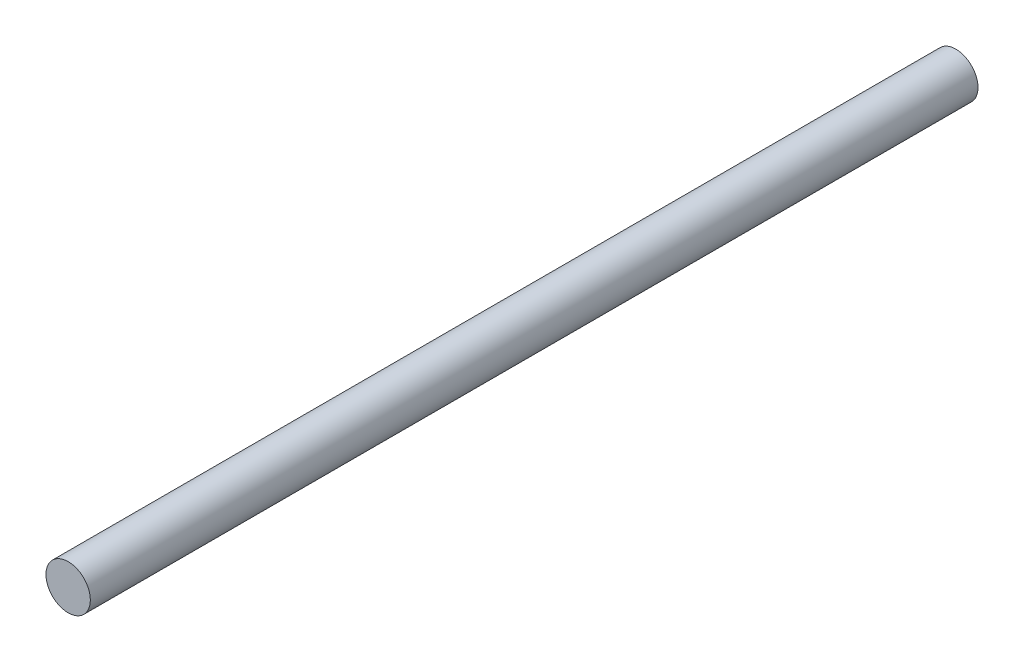
from build123d import *

# Parameters (mm, degrees)
SKETCH_1_R      = 10
EXTRUDE_1_DEPTH = 400


with BuildPart() as part:
    # 草图1 → 凸台-拉伸1 (new body)
    with BuildSketch(Plane.XY):
        Circle(SKETCH_1_R)
    extrude(amount=EXTRUDE_1_DEPTH)


solid = part.part
